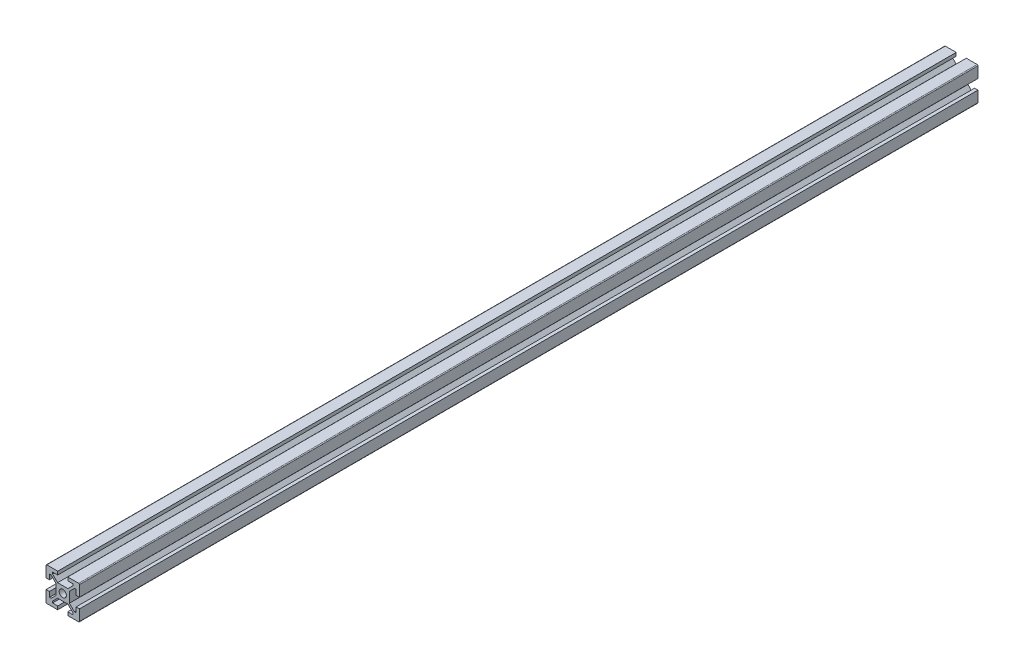
from build123d import *

# Parameters (mm, degrees)
SKETCH1_R           = 2.15
BOSS_EXTRUDE1_DEPTH = 537


with BuildPart() as part:
    # Sketch1 → Boss-Extrude1 (new body)
    with BuildSketch(Plane.XY):
        with BuildLine():
            Line((-3, 10), (-9.5, 10))
            ThreePointArc((-9.5, 10), (-9.853553391, 9.853553391), (-10, 9.5))
            Line((-10, 9.5), (-10, 3))
            Line((-10, 3), (-8, 3))
            Line((-8, 3), (-8, 6.080761184))
            Line((-8, 6.080761184), (-7, 6.080761184))
            Line((-7, 6.080761184), (-4, 3.080761184))
            Line((-4, 3.080761184), (-4, -3.080761184))
            Line((-4, -3.080761184), (-7, -6.080761184))
            Line((-7, -6.080761184), (-8, -6.080761184))
            Line((-8, -6.080761184), (-8, -3))
            Line((-8, -3), (-10, -3))
            Line((-10, -3), (-10, -9.5))
            ThreePointArc((-10, -9.5), (-9.853553391, -9.853553391), (-9.5, -10))
            Line((-9.5, -10), (-3, -10))
            Line((-3, -10), (-3, -8))
            Line((-3, -8), (-6.080761184, -8))
            Line((-6.080761184, -8), (-6.080761184, -7))
            Line((-6.080761184, -7), (-3.080761184, -4))
            Line((-3.080761184, -4), (3.080761184, -4))
            Line((3.080761184, -4), (6.080761184, -7))
            Line((6.080761184, -7), (6.080761184, -8))
            Line((6.080761184, -8), (3, -8))
            Line((3, -8), (3, -10))
            Line((3, -10), (9.5, -10))
            ThreePointArc((9.5, -10), (9.853553391, -9.853553391), (10, -9.5))
            Line((10, -9.5), (10, -3))
            Line((10, -3), (8, -3))
            Line((8, -3), (8, -6.080761184))
            Line((8, -6.080761184), (7, -6.080761184))
            Line((7, -6.080761184), (4, -3.080761184))
            Line((4, -3.080761184), (4, 3.080761184))
            Line((4, 3.080761184), (7, 6.080761184))
            Line((7, 6.080761184), (8, 6.080761184))
            Line((8, 6.080761184), (8, 3))
            Line((8, 3), (10, 3))
            Line((10, 3), (10, 9.5))
            ThreePointArc((10, 9.5), (9.853553391, 9.853553391), (9.5, 10))
            Line((9.5, 10), (3, 10))
            Line((3, 10), (3, 8))
            Line((3, 8), (6.080761184, 8))
            Line((6.080761184, 8), (6.080761184, 7))
            Line((6.080761184, 7), (3.080761184, 4))
            Line((3.080761184, 4), (-3.080761184, 4))
            Line((-3.080761184, 4), (-6.080761184, 7))
            Line((-6.080761184, 7), (-6.080761184, 8))
            Line((-6.080761184, 8), (-3, 8))
            Line((-3, 8), (-3, 10))
        make_face()
        Circle(SKETCH1_R, mode=Mode.SUBTRACT)
    extrude(amount=BOSS_EXTRUDE1_DEPTH)


solid = part.part
